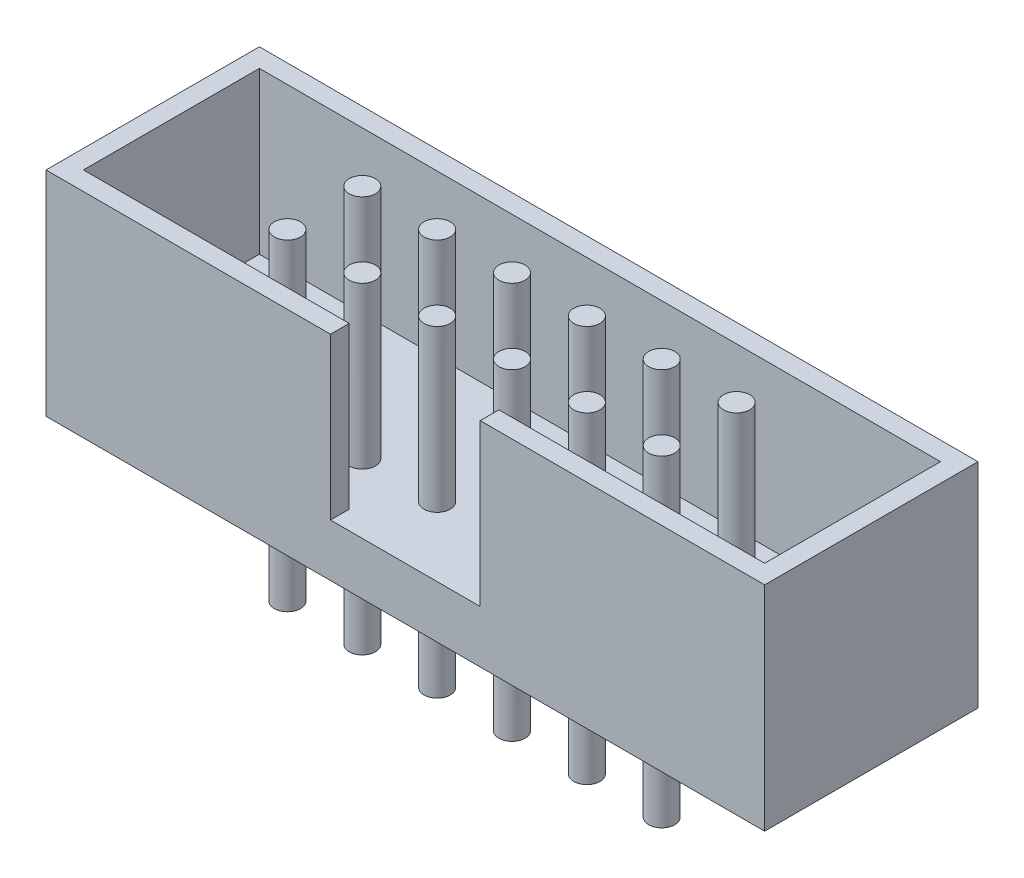
from build123d import *

# Parameters (mm, degrees)
SKETCH_1_W                  = 19.2
SKETCH_1_H                  = 5.7
EXTRUDE_1_DEPTH             = 5.7
SKETCH_2_W                  = 18.2
SKETCH_2_H                  = 4.7
CUT_EXTRUDE_1_DEPTH         = 4.3
CUT_EXTRUDE_2_REACH         = 22.824
SKETCH_3_W                  = 4
SKETCH_3_H                  = 4.3
SKETCH_4_R                  = 0.35
EXTRUDE_2_DEPTH             = 4.3
PATTERN_LINEAR_1_COUNT      = 6
PATTERN_LINEAR_1_PITCH      = 2
PATTERN_LINEAR_1_COUNT_DIR2 = 2
PATTERN_LINEAR_1_PITCH_DIR2 = 2


with BuildPart() as part:
    # 草图1 → 凸台-拉伸1 (new body)
    with BuildSketch(Plane(origin=(0, 0, 0), x_dir=(1, 0, 0), z_dir=(0, 1, 0))):
        with Locations((9.6, 2.85)):
            Rectangle(SKETCH_1_W, SKETCH_1_H)
    extrude(amount=EXTRUDE_1_DEPTH)

    # 草图2 → 切除-拉伸1 (cut)
    with BuildSketch(Plane(origin=(0, 5.7, 0), x_dir=(1, 0, 0), z_dir=(0, 1, 0))):
        with Locations((9.6, 2.85)):
            Rectangle(SKETCH_2_W, SKETCH_2_H)
    extrude(amount=-CUT_EXTRUDE_1_DEPTH, mode=Mode.SUBTRACT)

    # 草图3 → 切除-拉伸2 (cut, up to next)
    with BuildSketch(Plane.XY, mode=Mode.PRIVATE) as cut_extrude_2_sk1:
        with Locations((9.6, 3.55)):
            Rectangle(SKETCH_3_W, SKETCH_3_H)
    cut_extrude_2_tool1 = extrude(cut_extrude_2_sk1.sketch, amount=-CUT_EXTRUDE_2_REACH, mode=Mode.PRIVATE) & part.part
    add(cut_extrude_2_tool1.solids().sort_by_distance((9.6, 3.55, 0))[0], mode=Mode.SUBTRACT)

    # 草图4 → 凸台-拉伸2 (add, symmetric)
    with BuildSketch(Plane(origin=(0, 1.4, 0), x_dir=(1, 0, 0), z_dir=(0, 1, 0))):
        with Locations(Location((4.6, 3.85, 0), (0, 0, 90))):
            Circle(SKETCH_4_R)
    extrude_2 = extrude(amount=EXTRUDE_2_DEPTH, both=True)

    # 阵列(线性)1: Extrude 2 6 × 2
    with Locations(*[(i * PATTERN_LINEAR_1_PITCH, 0, j * PATTERN_LINEAR_1_PITCH_DIR2) for i in range(PATTERN_LINEAR_1_COUNT) for j in range(PATTERN_LINEAR_1_COUNT_DIR2) if (i, j) != (0, 0)]):
        add(extrude_2)


solid = part.part
